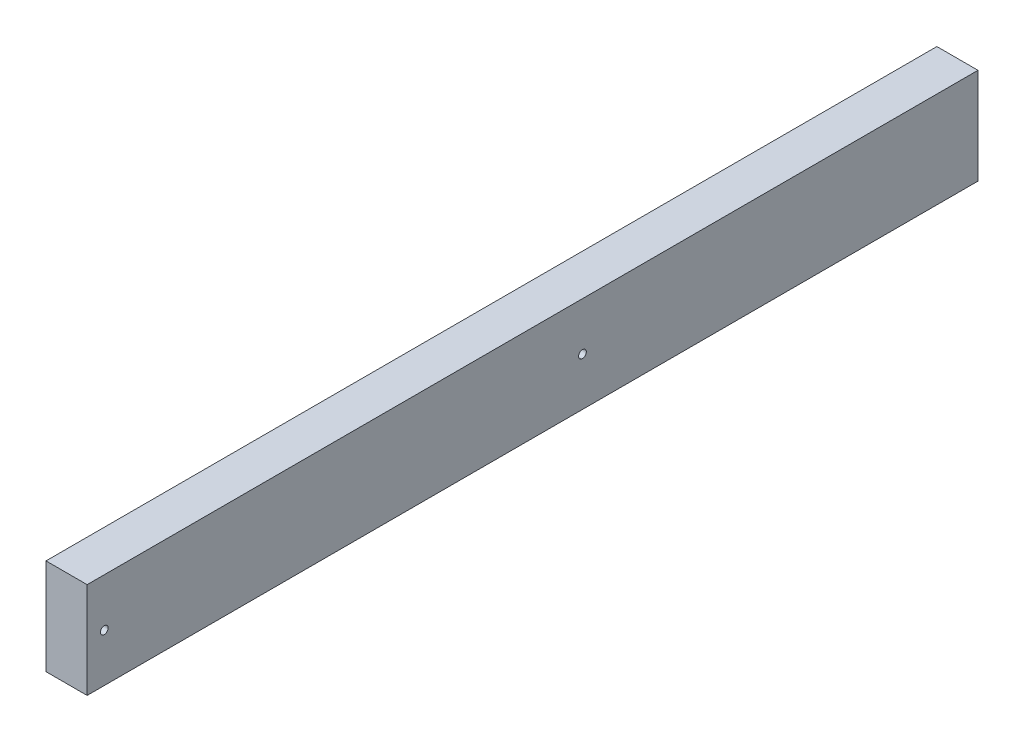
from build123d import *

# Parameters (mm, degrees)
SKETCH1_W           = 825.177208973
SKETCH1_H           = 88.9
BOSS_EXTRUDE1_DEPTH = 38.1
SKETCH2_R           = 3.571875
CUT_EXTRUDE1_DEPTH  = 831.826243091


with BuildPart() as part:
    # Sketch1 → Boss-Extrude1 (new body)
    with BuildSketch(Plane(origin=(0, 0, 0), x_dir=(0, 0, -1), z_dir=(1, 0, 0))):
        with Locations((412.588604487, 44.45)):
            Rectangle(SKETCH1_W, SKETCH1_H)
    extrude(amount=BOSS_EXTRUDE1_DEPTH)

    # Sketch2 → Cut-Extrude1 (cut, through all)
    with BuildSketch(Plane(origin=(38.1, 0, 0), x_dir=(0, 0, -1), z_dir=(1, 0, 0))):
        with Locations((15.875, 44.45)):
            Circle(SKETCH2_R)
        with Locations((458.7875, 44.45)):
            Circle(SKETCH2_R)
    extrude(amount=-CUT_EXTRUDE1_DEPTH, mode=Mode.SUBTRACT)


solid = part.part
